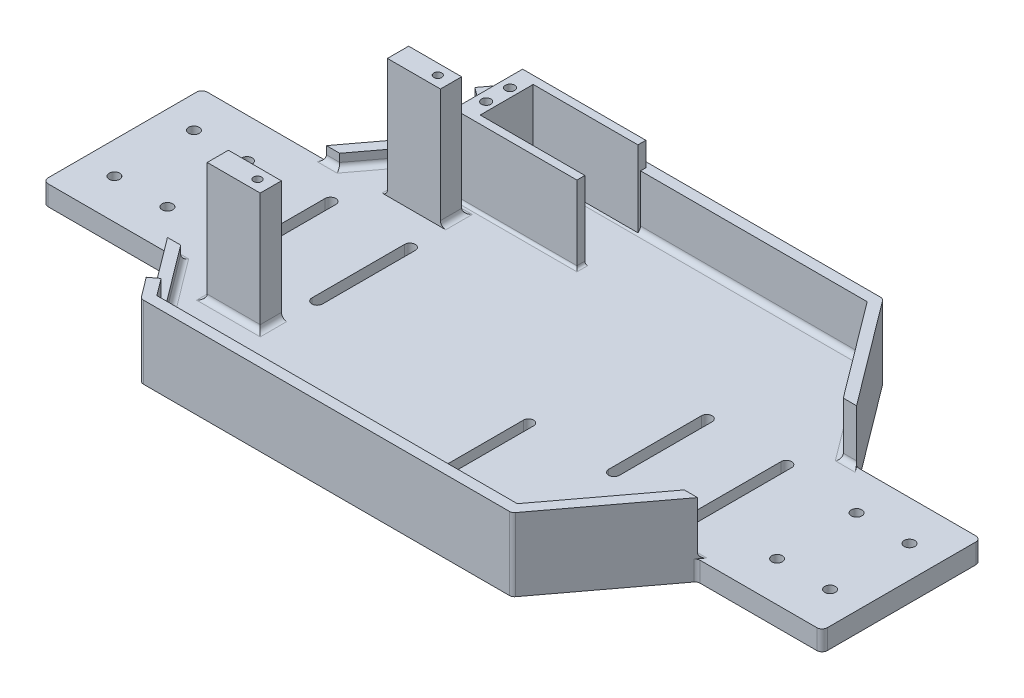
from build123d import *

# Parameters (mm, degrees)
SKETCH1_W            = 47
SKETCH1_H            = 60
SKETCH1_W_2          = 140
SKETCH1_H_2          = 140
BOSS_EXTRUDE1_DEPTH  = 7.5
SKETCH2_R            = 2
CUT_EXTRUDE1_DEPTH   = 10
BOSS_EXTRUDE2_DEPTH  = 20
CUT_EXTRUDE3_DEPTH   = 10
FILLET5_R            = 2
FILLET6_R            = 2
FILLET7_R            = 2
SKETCH12_W           = 15.204619521
SKETCH12_H           = 41.964749879
BOSS_EXTRUDE3_DEPTH  = 7.5
SKETCH13_W           = 40
SKETCH13_H           = 15
CUT_EXTRUDE4_DEPTH   = 10
SKETCH15_W           = 20
SKETCH15_H           = 8
BOSS_EXTRUDE4_DEPTH  = 45
SKETCH16_R           = 1.5
CUT_EXTRUDE5_DEPTH   = 8
FILLET9_R            = 2
FILLET9_OF_MIRROR5_R = 2
BOSS_EXTRUDE5_DEPTH  = 29
FILLET10_R           = 1
SKETCH18_R           = 1.75
CUT_EXTRUDE6_DEPTH   = 15
SKETCH19_W           = 12.583718204
SKETCH19_H           = 7.390312174
CUT_EXTRUDE7_DEPTH   = 10
FILLET11_R           = 2


with BuildPart() as part:
    # Sketch1 → Boss-Extrude1 (new body)
    with BuildSketch(Plane(origin=(0, 0, 0), x_dir=(1, 0, 0), z_dir=(0, 1, 0))):
        with Locations((-123.5, 0)):
            Rectangle(SKETCH1_W, SKETCH1_H)
        Polygon((-100, 30), (-100, -30), (-70, -70), (-70, 70), align=None)
        Rectangle(SKETCH1_W_2, SKETCH1_H_2)
        Polygon((100, 30), (100, -30), (70, -70), (70, 70), align=None)
        with Locations((123.5, 0)):
            Rectangle(SKETCH1_W, SKETCH1_H)
    extrude(amount=BOSS_EXTRUDE1_DEPTH)

    # Sketch2 → Cut-Extrude1 (cut)
    with BuildSketch(Plane(origin=(0, 7.5, 0), x_dir=(1, 0, 0), z_dir=(0, 1, 0))):
        with Locations(Location((-135, 15, 0), (0, 0, 270))):
            Circle(SKETCH2_R)
        with Locations(Location((-115, 15, 0), (0, 0, 270))):
            Circle(SKETCH2_R)
        with Locations(Location((-135, -15, 0), (0, 0, 270))):
            Circle(SKETCH2_R)
        with Locations(Location((-115, -15, 0), (0, 0, 270))):
            Circle(SKETCH2_R)
    cut_extrude1 = extrude(amount=-CUT_EXTRUDE1_DEPTH, mode=Mode.SUBTRACT)

    # Sketch8 → Boss-Extrude2 (add)
    with BuildSketch(Plane(origin=(0, 7.5, 0), x_dir=(1, 0, 0), z_dir=(0, 1, 0))):
        Polygon((-100, 30), (-70, 70), (70, 70), (100, 30), (95, 30), (68, 66), (-68, 66), (-95, 30), align=None)
        Polygon((-100, -30), (-70, -70), (70, -70), (100, -30), (95, -30), (68, -66), (-68, -66), (-95, -30), align=None)
    extrude(amount=BOSS_EXTRUDE2_DEPTH)

    # Mirror1: Cut-Extrude1 across plane
    add(cut_extrude1.mirror(Plane(origin=(0, 0, 0), x_dir=(0, 0, 1), z_dir=(1, 0, 0))), mode=Mode.SUBTRACT)

    # Sketch11 → Cut-Extrude3 (cut)
    with BuildSketch(Plane(origin=(0, 7.5, 0), x_dir=(1, 0, 0), z_dir=(0, 1, 0))):
        with BuildLine():
            Line((58, -17.5), (58, 17.5))
            ThreePointArc((58, 17.5), (56, 19.5), (54, 17.5))
            Line((54, 17.5), (54, -17.5))
            ThreePointArc((54, -17.5), (56, -19.5), (58, -17.5))
        make_face()
        with BuildLine():
            Line((84, -17.5), (84, 17.5))
            ThreePointArc((84, 17.5), (86, 19.5), (88, 17.5))
            Line((88, 17.5), (88, -17.5))
            ThreePointArc((88, -17.5), (86, -19.5), (84, -17.5))
        make_face()
        with BuildLine():
            Line((21.85, -17.5), (21.85, -47.5))
            ThreePointArc((21.85, -47.5), (23.75, -49.4), (25.65, -47.5))
            Line((25.65, -47.5), (25.65, -17.5))
            ThreePointArc((25.65, -17.5), (23.75, -15.6), (21.85, -17.5))
        make_face()
    cut_extrude3 = extrude(amount=-CUT_EXTRUDE3_DEPTH, mode=Mode.SUBTRACT)

    # Fillet5
    fillet5_edges = [part.edges().sort_by_distance(p)[0] for p in [
        (-147, 3.75, 30),
        (-147, 3.75, -30),
        (-100, 3.75, -30),
        (-70, 13.75, -70),
        (70, 13.75, -70),
        (100, 3.75, -30),
        (147, 3.75, -30),
        (147, 3.75, 30),
        (100, 3.75, 30),
        (70, 13.75, 70),
        (-70, 13.75, 70),
        (-100, 3.75, 30),
    ]]
    fillet(fillet5_edges, radius=FILLET5_R)

    # Fillet6
    fillet6_edges = [part.edges().sort_by_distance(p)[0] for p in [
        (-81.5, 7.5, -48),
        (0, 7.5, -66),
        (81.5, 7.5, -48),
        (81.5, 7.5, 48),
        (0, 7.5, 66),
        (-81.5, 7.5, 48),
    ]]
    fillet(fillet6_edges, radius=FILLET6_R)

    # Fillet7
    fillet7_edges = [part.edges().sort_by_distance(p)[0] for p in [
        (96.25, 7.5, 30),
        (-96.25, 7.5, 30),
        (-96.25, 7.5, -30),
        (96.25, 7.5, -30),
    ]]
    fillet(fillet7_edges, radius=FILLET7_R)

    # Mirror2: Cut-Extrude3 across plane
    add(cut_extrude3.mirror(Plane(origin=(0, 0, 0), x_dir=(0, 0, 1), z_dir=(1, 0, 0))), mode=Mode.SUBTRACT)

    # Sketch12 → Boss-Extrude3 (add)
    with BuildSketch(Plane(origin=(0, 7.5, 0), x_dir=(1, 0, 0), z_dir=(0, 1, 0))):
        with Locations((-23.111021673, -33.450162947)):
            Rectangle(SKETCH12_W, SKETCH12_H)
    extrude(amount=-BOSS_EXTRUDE3_DEPTH)

    # Sketch13 → Cut-Extrude4 (cut)
    with BuildSketch(Plane(origin=(-78.4, 0, 58.8), x_dir=(0.6, 0, 0.8), z_dir=(-0.8, 0, 0.6))):
        with Locations((-16, 20)):
            Rectangle(SKETCH13_W, SKETCH13_H)
    cut_extrude4 = extrude(amount=-CUT_EXTRUDE4_DEPTH, mode=Mode.SUBTRACT)

    # Mirror3: Cut-Extrude4 across plane
    add(cut_extrude4.mirror(Plane.XY), mode=Mode.SUBTRACT)

    # Sketch15 → Boss-Extrude4 (add)
    with BuildSketch(Plane(origin=(0, 7.5, 0), x_dir=(1, 0, 0), z_dir=(0, 1, 0))):
        with Locations((-67, -34)):
            Rectangle(SKETCH15_W, SKETCH15_H)
    boss_extrude4 = extrude(amount=BOSS_EXTRUDE4_DEPTH)

    # Sketch16 → Cut-Extrude5 (cut)
    with BuildSketch(Plane(origin=(0, 52.5, 0), x_dir=(1, 0, 0), z_dir=(0, 1, 0))):
        with Locations(Location((-62, -34, 0), (0, 0, 270))):
            Circle(SKETCH16_R)
    cut_extrude5 = extrude(amount=-CUT_EXTRUDE5_DEPTH, mode=Mode.SUBTRACT)

    # Fillet9
    fillet9_edges = [part.edges().sort_by_distance(p)[0] for p in [
        (-77, 7.5, 34),
    ]]
    fillet(fillet9_edges, radius=FILLET9_R)

    # Mirror5: Boss-Extrude4, Cut-Extrude5 across plane
    add(boss_extrude4.mirror(Plane.XY))
    add(cut_extrude5.mirror(Plane.XY), mode=Mode.SUBTRACT)

    # Fillet9 of Mirror5
    fillet9_of_mirror5_edges = [part.edges().sort_by_distance(p)[0] for p in [
        (-77, 7.5, -34),
    ]]
    fillet(fillet9_of_mirror5_edges, radius=FILLET9_OF_MIRROR5_R)

    # Sketch17 → Boss-Extrude5 (add)
    with BuildSketch(Plane(origin=(0, 7.5, 0), x_dir=(1, 0, 0), z_dir=(0, 1, 0))):
        Polygon((-64, 68), (-64, 42), (-17.5, 42), (-17.5, 45), (-57, 45), (-57, 65), (-17.5, 65), (-17.5, 68), align=None)
    extrude(amount=BOSS_EXTRUDE5_DEPTH)

    # Fillet10
    fillet10_edges = [part.edges().sort_by_distance(p)[0] for p in [
        (-64, 8.085786438, -65.414213562),
        (-64, 18.5, -66),
        (-64, 7.5, -53),
        (-40.75, 7.5, -42),
        (-17.5, 7.5, -43.5),
    ]]
    fillet(fillet10_edges, radius=FILLET10_R)

    # Sketch18 → Cut-Extrude6 (cut)
    with BuildSketch(Plane(origin=(0, 36.5, 0), x_dir=(1, 0, 0), z_dir=(0, 1, 0))):
        with Locations(Location((-60.25, 50.5, 0), (0, 0, 270))):
            Circle(SKETCH18_R)
        with Locations(Location((-60.25, 59.5, 0), (0, 0, 270))):
            Circle(SKETCH18_R)
    extrude(amount=-CUT_EXTRUDE6_DEPTH, mode=Mode.SUBTRACT)

    # Sketch19 → Cut-Extrude7 (cut)
    with BuildSketch(Plane.ZY.offset(64)):
        with Locations((-53.897066291, 12.195156087)):
            Rectangle(SKETCH19_W, SKETCH19_H)
    extrude(amount=-CUT_EXTRUDE7_DEPTH, mode=Mode.SUBTRACT)

    # Fillet11
    fillet11_edges = [part.edges().sort_by_distance(p)[0] for p in [
        (-68, 7.5, -38),
        (-57, 7.5, -34),
        (-57, 7.5, 34),
        (-68, 7.5, 38),
    ]]
    fillet(fillet11_edges, radius=FILLET11_R)


solid = part.part
